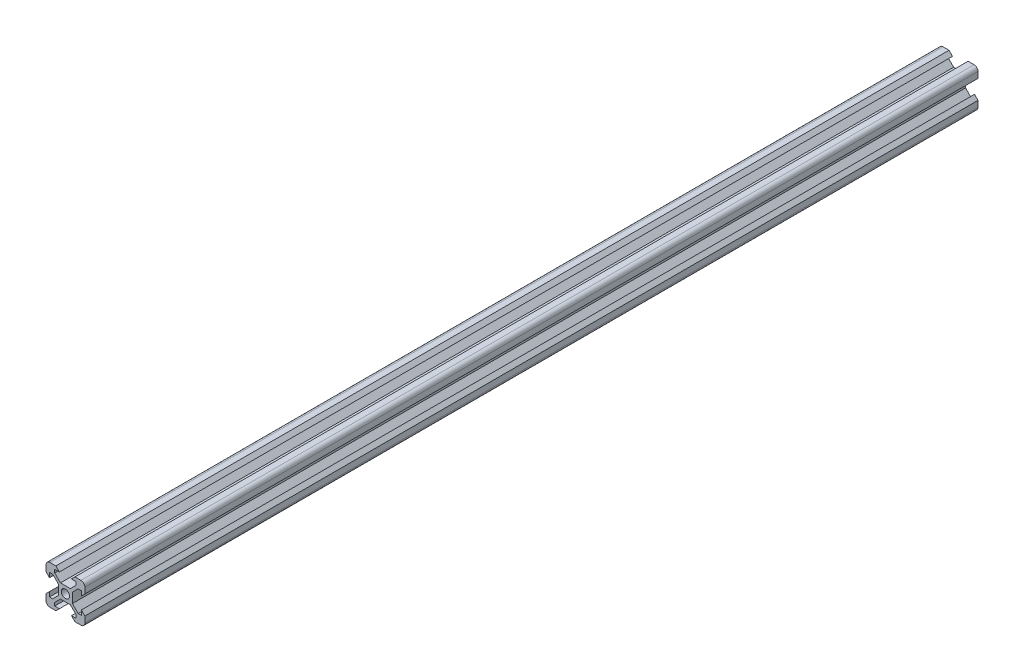
from build123d import *

# Parameters (mm, degrees)
SKETCH1_R           = 2.1
BOSS_EXTRUDE1_DEPTH = 460


with BuildPart() as part:
    # Sketch1 → Boss-Extrude1 (new body)
    with BuildSketch(Plane.XY):
        with BuildLine():
            Line((-4.9, -10), (-3.1, -8.2))
            Line((-3.1, -8.2), (-5.5, -8.2))
            Line((-5.5, -8.2), (-5.5, -6.560660172))
            Line((-5.5, -6.560660172), (-2.539339828, -3.6))
            Line((-2.539339828, -3.6), (2.539339828, -3.6))
            Line((2.539339828, -3.6), (5.5, -6.560660172))
            Line((5.5, -6.560660172), (5.5, -8.2))
            Line((5.5, -8.2), (3.1, -8.2))
            Line((3.1, -8.2), (4.9, -10))
            Line((4.9, -10), (8, -10))
            ThreePointArc((8, -10), (9.414213562, -9.414213562), (10, -8))
            Line((10, -8), (10, -4.9))
            Line((10, -4.9), (8.2, -3.1))
            Line((8.2, -3.1), (8.2, -5.5))
            Line((8.2, -5.5), (6.560660172, -5.5))
            Line((6.560660172, -5.5), (3.6, -2.539339828))
            Line((3.6, -2.539339828), (3.6, 2.539339828))
            Line((3.6, 2.539339828), (6.560660172, 5.5))
            Line((6.560660172, 5.5), (8.2, 5.5))
            Line((8.2, 5.5), (8.2, 3.1))
            Line((8.2, 3.1), (10, 4.9))
            Line((10, 4.9), (10, 8))
            ThreePointArc((10, 8), (9.414213562, 9.414213562), (8, 10))
            Line((8, 10), (4.9, 10))
            Line((4.9, 10), (3.1, 8.2))
            Line((3.1, 8.2), (5.5, 8.2))
            Line((5.5, 8.2), (5.5, 6.560660172))
            Line((5.5, 6.560660172), (2.539339828, 3.6))
            Line((2.539339828, 3.6), (-2.539339828, 3.6))
            Line((-2.539339828, 3.6), (-5.5, 6.560660172))
            Line((-5.5, 6.560660172), (-5.5, 8.2))
            Line((-5.5, 8.2), (-3.1, 8.2))
            Line((-3.1, 8.2), (-4.9, 10))
            Line((-4.9, 10), (-8, 10))
            ThreePointArc((-8, 10), (-9.414213562, 9.414213562), (-10, 8))
            Line((-10, 8), (-10, 4.9))
            Line((-10, 4.9), (-8.2, 3.1))
            Line((-8.2, 3.1), (-8.2, 5.5))
            Line((-8.2, 5.5), (-6.560660172, 5.5))
            Line((-6.560660172, 5.5), (-3.6, 2.539339828))
            Line((-3.6, 2.539339828), (-3.6, -2.539339828))
            Line((-3.6, -2.539339828), (-6.560660172, -5.5))
            Line((-6.560660172, -5.5), (-8.2, -5.5))
            Line((-8.2, -5.5), (-8.2, -3.1))
            Line((-8.2, -3.1), (-10, -4.9))
            Line((-10, -4.9), (-10, -8))
            ThreePointArc((-10, -8), (-9.414213562, -9.414213562), (-8, -10))
            Line((-8, -10), (-4.9, -10))
        make_face()
        Circle(SKETCH1_R, mode=Mode.SUBTRACT)
    extrude(amount=BOSS_EXTRUDE1_DEPTH)


solid = part.part
